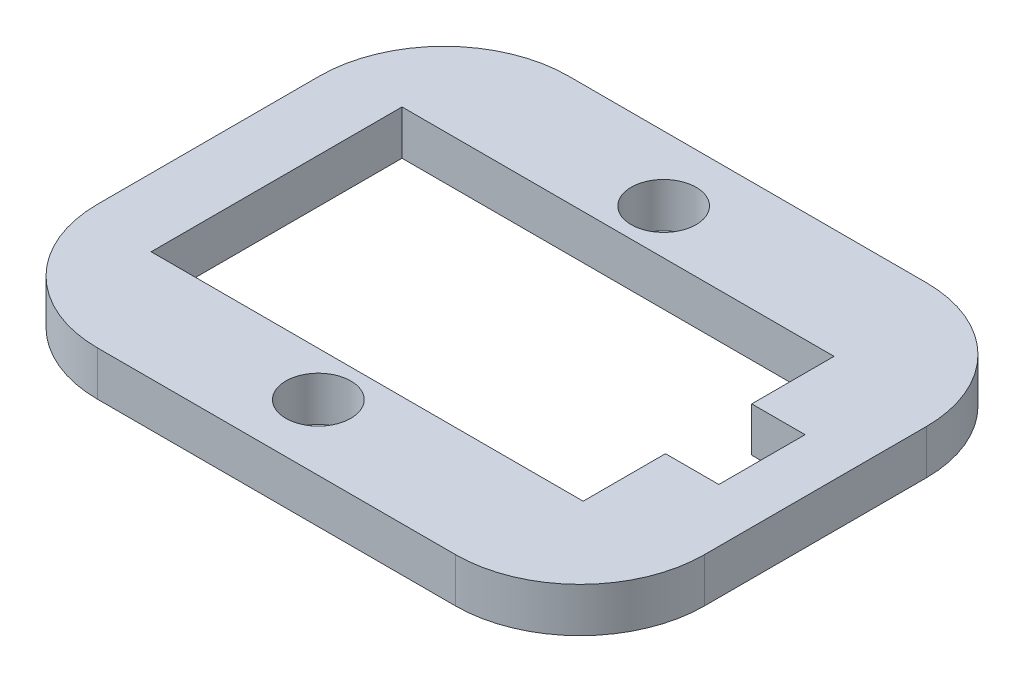
from build123d import *

# Parameters (mm, degrees)
SKETCH2_R           = 1.825
BOSS_EXTRUDE1_DEPTH = 1.25


with BuildPart() as part:
    # Sketch2 → Boss-Extrude1 (new, symmetric)
    with BuildSketch(Plane(origin=(0, 0, 0), x_dir=(1, 0, 0), z_dir=(0, 1, 0))):
        with BuildLine():
            Line((-9.701491638, 14.016578985), (10.422938362, 14.016578985))
            ThreePointArc((10.422938362, 14.016578985), (15.37268583, 11.966326454), (17.422938362, 7.016578985))
            Line((17.422938362, 7.016578985), (17.422938362, -5.461573784))
            ThreePointArc((17.422938362, -5.461573784), (15.37268583, -10.411321253), (10.422938362, -12.461573784))
            Line((10.422938362, -12.461573784), (-9.701491638, -12.461573784))
            ThreePointArc((-9.701491638, -12.461573784), (-14.651239107, -10.411321253), (-16.701491638, -5.461573784))
            Line((-16.701491638, -5.461573784), (-16.701491638, 7.016578985))
            ThreePointArc((-16.701491638, 7.016578985), (-14.651239107, 11.966326454), (-9.701491638, 14.016578985))
        make_face()
        with Locations(Location((-0.702610465, 10.366481865, 0), (0, 0, 270))):
            Circle(SKETCH2_R, mode=Mode.SUBTRACT)
        with Locations(Location((-0.97805, -8.773518135, 0), (0, 0, 270))):
            Circle(SKETCH2_R, mode=Mode.SUBTRACT)
        Polygon((-12.878350873, 7.83354898), (11.411239127, 7.83354898), (11.411239127, 3.2058826), (14.411239127, 3.2058826), (14.411239127, -1.6439074), (11.411239127, -1.6439074), (11.411239127, -6.27157378), (-12.878350873, -6.27157378), align=None, mode=Mode.SUBTRACT)
    extrude(amount=BOSS_EXTRUDE1_DEPTH, both=True)


solid = part.part
